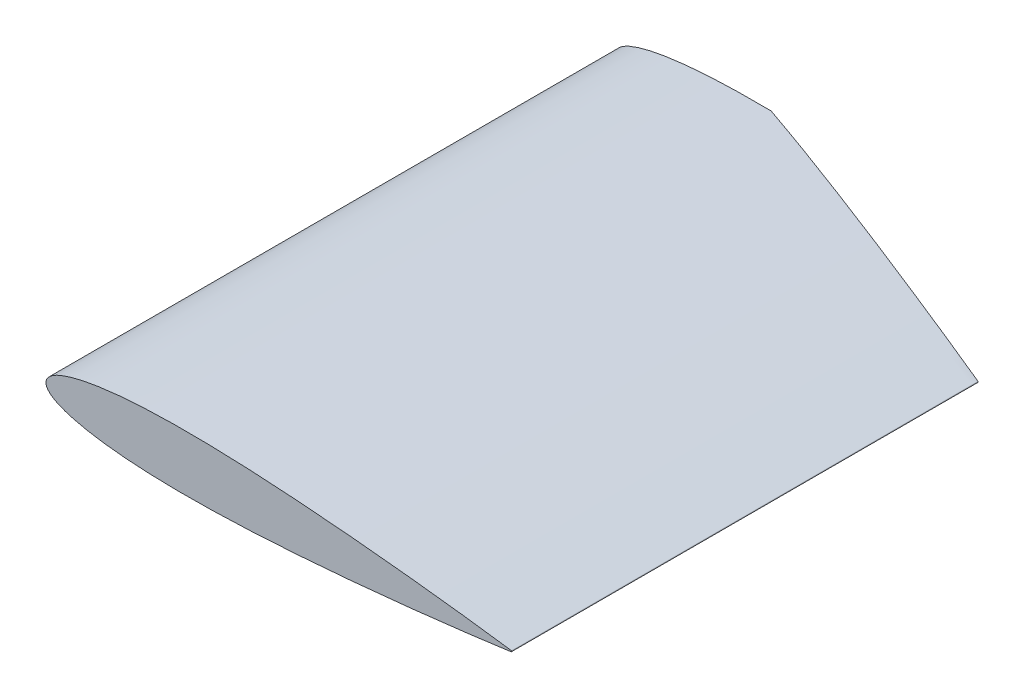
from build123d import *

# Parameters (mm, degrees)
BOSS_EXTRUDE1_DEPTH            = 279.908
SKETCH2_R                      = 6.35
CUT_EXTRUDE1_DEPTH             = 127
CUT_EXTRUDE2_REACH             = 363.655
CUT_EXTRUDE2_DIRECTION_2_REACH = 363.655


with BuildPart() as part:
    # Sketch1 → Boss-Extrude1 (new body)
    with BuildSketch(Plane.XY):
        with BuildLine():
            add(Edge.make_bspline(
                [(0, 0), (0, -0.328477994), (0.094132544, -1.002317273), (0.516328799, -1.979047664), (1.206253084, -2.919084286), (2.155530292, -3.826507135), (3.361088978, -4.704503454), (4.821173785, -5.55391213), (6.533647864, -6.373768076), (8.495474965, -7.162212853), (10.702763054, -7.916899641), (13.150800968, -8.635300083), (15.834201004, -9.314707599), (18.746872001, -9.952655748), (21.882185807, -10.546523838), (25.23289446, -11.094151144), (28.791264659, -11.593290214), (32.549019843, -12.042255982), (36.4974269, -12.43944474), (40.627278951, -12.783751315), (44.928952977, -13.074379275), (49.392427762, -13.310840666), (54.00728167, -13.493188322), (58.76274015, -13.621763124), (63.647705329, -13.697267659), (68.650780173, -13.72087076), (73.760279514, -13.693983832), (78.964273059, -13.618365131), (84.250609651, -13.496063622), (89.606956912, -13.329404125), (95.020804226, -13.120820839), (100.479505937, -12.87299727), (105.970317865, -12.588746266), (111.480424999, -12.270931467), (116.996960654, -11.922505449), (122.507041698, -11.546430916), (127.997806048, -11.145660598), (133.456428211, -10.723198576), (138.870163217, -10.281871752), (144.226358514, -9.824563044), (149.512524459, -9.354044127), (154.7162998, -8.873020616), (159.825543847, -8.384191905), (164.828306858, -7.890045542), (169.712928008, -7.393148198), (174.467978148, -6.895915808), (179.082363681, -6.400793333), (183.545298009, -5.91018943), (187.846354056, -5.426302321), (191.975503597, -4.951590796), (195.923094736, -4.488262398), (199.679907253, -4.038593513), (203.237156328, -3.604799783), (206.586548753, -3.189155079), (209.720252989, -2.793754916), (212.630956022, -2.420810863), (215.311847817, -2.072241054), (217.75667572, -1.750168635), (219.959752272, -1.4563836), (221.915845594, -1.192545194), (223.620666071, -0.960790622), (225.069395854, -0.760875596), (226.261037983, -0.598983787), (227.186433997, -0.462932704), (227.858906671, -0.385743815), (228.245225393, -0.302214543), (228.641481893, -0.309763383), (228.641481893, 0.309763383), (228.245225393, 0.302214543), (227.858906671, 0.385743815), (227.186433997, 0.462932704), (226.261037983, 0.598983787), (225.069395854, 0.760875596), (223.620666071, 0.960790622), (221.915845594, 1.192545194), (219.959752272, 1.4563836), (217.75667572, 1.750168635), (215.311847817, 2.072241054), (212.630956022, 2.420810863), (209.720252989, 2.793754916), (206.586548753, 3.189155079), (203.237156328, 3.604799783), (199.679907253, 4.038593513), (195.923094736, 4.488262398), (191.975503597, 4.951590796), (187.846354056, 5.426302321), (183.545298009, 5.91018943), (179.082363681, 6.400793333), (174.467978148, 6.895915808), (169.712928008, 7.393148198), (164.828306858, 7.890045542), (159.825543847, 8.384191905), (154.7162998, 8.873020616), (149.512524459, 9.354044127), (144.226358514, 9.824563044), (138.870163217, 10.281871752), (133.456428211, 10.723198576), (127.997806048, 11.145660598), (122.507041698, 11.546430916), (116.996960654, 11.922505449), (111.480424999, 12.270931467), (105.970317865, 12.588746266), (100.479505937, 12.87299727), (95.020804226, 13.120820839), (89.606956912, 13.329404125), (84.250609651, 13.496063622), (78.964273059, 13.618365131), (73.760279514, 13.693983832), (68.650780173, 13.72087076), (63.647705329, 13.697267659), (58.76274015, 13.621763124), (54.00728167, 13.493188322), (49.392427762, 13.310840666), (44.928952977, 13.074379275), (40.627278951, 12.783751315), (36.4974269, 12.43944474), (32.549019843, 12.042255982), (28.791264659, 11.593290214), (25.23289446, 11.094151144), (21.882185807, 10.546523838), (18.746872001, 9.952655748), (15.834201004, 9.314707599), (13.150800968, 8.635300083), (10.702763054, 7.916899641), (8.495474965, 7.162212853), (6.533647864, 6.373768076), (4.821173785, 5.55391213), (3.361088978, 4.704503454), (2.155530292, 3.826507135), (1.206253084, 2.919084286), (0.516328799, 1.979047664), (0.094132544, 1.002317273), (0, 0.328477994), (0, 0)],
                knots=[0, 0, 0, 0, 0.002106168, 0.00432059, 0.006772783, 0.009556697, 0.012734041, 0.016342888, 0.020405604, 0.024934102, 0.029933071, 0.035402241, 0.04133743, 0.04773159, 0.054575389, 0.061857405, 0.069564571, 0.077682311, 0.086194684, 0.095084441, 0.104333244, 0.1139217, 0.123829339, 0.134034708, 0.144515531, 0.155248716, 0.166210356, 0.177375783, 0.188719821, 0.200216647, 0.211839951, 0.223562989, 0.235358653, 0.247199625, 0.259058395, 0.270907226, 0.282718457, 0.294464514, 0.306117689, 0.317650771, 0.329036618, 0.34024851, 0.351259999, 0.362045273, 0.372578891, 0.382836142, 0.392792739, 0.40242532, 0.411711115, 0.420628244, 0.429155673, 0.437273179, 0.444961561, 0.452202575, 0.458979063, 0.465274876, 0.471074963, 0.476365569, 0.481133961, 0.485368768, 0.489059784, 0.492198148, 0.494776266, 0.49678801, 0.498228425, 0.499094073, 0.499382862, 0.500617138, 0.500905927, 0.501771575, 0.50321199, 0.505223734, 0.507801852, 0.510940216, 0.514631232, 0.518866039, 0.523634431, 0.528925037, 0.534725124, 0.541020937, 0.547797425, 0.555038439, 0.562726821, 0.570844327, 0.579371756, 0.588288885, 0.59757468, 0.607207261, 0.617163858, 0.627421109, 0.637954727, 0.648740001, 0.65975149, 0.670963382, 0.682349229, 0.693882311, 0.705535486, 0.717281543, 0.729092774, 0.740941605, 0.752800375, 0.764641347, 0.776437011, 0.788160049, 0.799783353, 0.811280179, 0.822624217, 0.833789644, 0.844751284, 0.855484469, 0.865965292, 0.876170661, 0.8860783, 0.895666756, 0.904915559, 0.913805316, 0.922317689, 0.930435429, 0.938142595, 0.945424611, 0.95226841, 0.95866257, 0.964597759, 0.970066929, 0.975065898, 0.979594396, 0.983657112, 0.987265959, 0.990443303, 0.993227217, 0.99567941, 0.997893832, 1, 1, 1, 1], degree=3))
        make_face()
    extrude(amount=BOSS_EXTRUDE1_DEPTH)

    # Sketch2 → Cut-Extrude1 (cut)
    with BuildSketch(Plane(origin=(0, 0, 0), x_dir=(-1, 0, 0), z_dir=(0, 0, -1))):
        with Locations((-63.5, 0)):
            Circle(SKETCH2_R)
    extrude(amount=-CUT_EXTRUDE1_DEPTH, mode=Mode.SUBTRACT)

    # Sketch3 → Cut-Extrude2 (cut, up to next)
    with BuildSketch(Plane(origin=(0, 0, 0), x_dir=(1, 0, 0), z_dir=(0, 1, 0)), mode=Mode.PRIVATE) as cut_extrude2_sk1:
        Polygon((228.654985762, 0), (228.6, -50.8), (76.2, 0), align=None)
    cut_extrude2_tool1 = extrude(cut_extrude2_sk1.sketch, amount=-CUT_EXTRUDE2_REACH, mode=Mode.PRIVATE) & part.part
    add(cut_extrude2_tool1.solids().sort_by_distance((177.818329, 0, 16.933333))[0], mode=Mode.SUBTRACT)

    # Sketch3 → Cut-Extrude2 direction 2 (cut, up to next)
    with BuildSketch(Plane(origin=(0, 0, 0), x_dir=(1, 0, 0), z_dir=(0, 1, 0)), mode=Mode.PRIVATE) as cut_extrude2_direction_2_sk1:
        Polygon((228.654985762, 0), (228.6, -50.8), (76.2, 0), align=None)
    cut_extrude2_direction_2_tool1 = extrude(cut_extrude2_direction_2_sk1.sketch, amount=CUT_EXTRUDE2_DIRECTION_2_REACH, mode=Mode.PRIVATE) & part.part
    add(cut_extrude2_direction_2_tool1.solids().sort_by_distance((177.818329, 0, 16.933333))[0], mode=Mode.SUBTRACT)


solid = part.part
